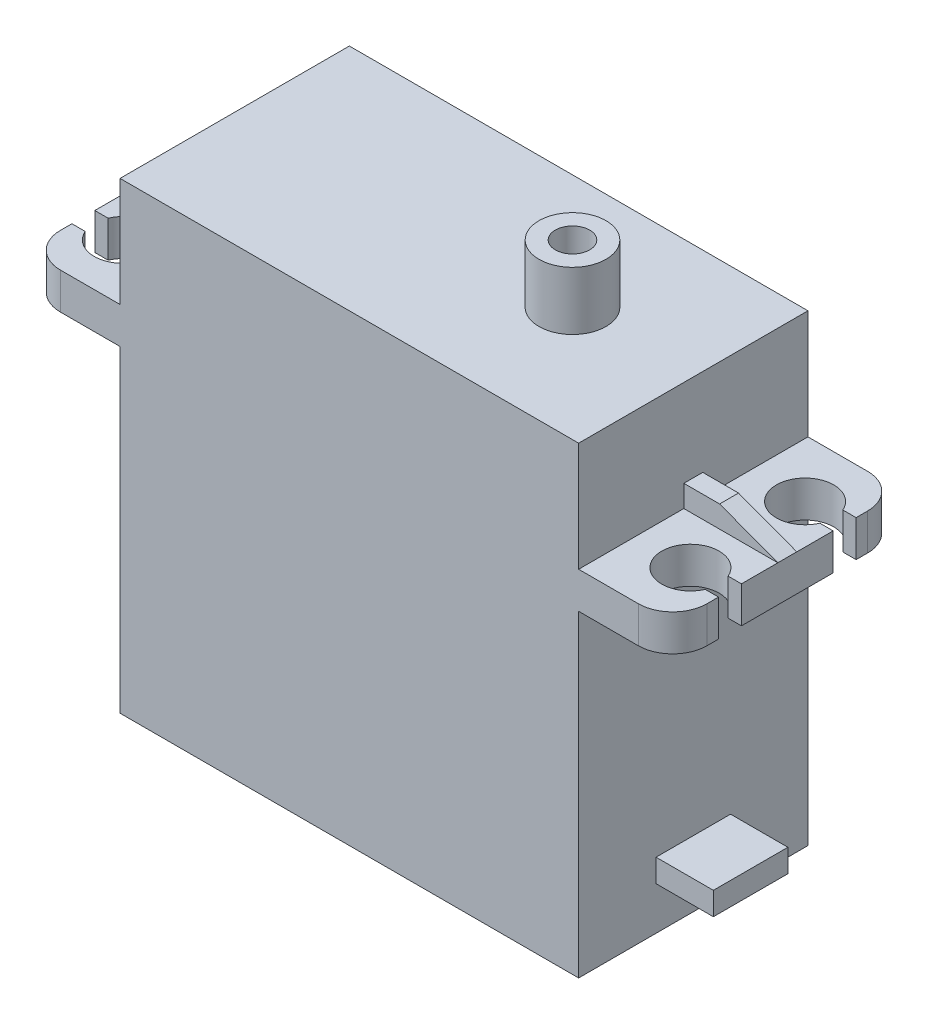
from build123d import *

# Parameters (mm, degrees)
SKETCH1_W            = 40
SKETCH1_H            = 20
BOSS_EXTRUDE1_DEPTH  = 40.4
SKETCH2_W            = 56.4
SKETCH2_H            = 20
BOSS_EXTRUDE2_DEPTH  = 3.175
CUT_EXTRUDE1_REACH   = 44.994
SKETCH3_R            = 2.5
CUT_EXTRUDE2_REACH   = 44.994
MIRROR2_COPY_1_REACH = 44.994
FILLET1_R            = 3
SKETCH5_W            = 6.5
SKETCH5_H            = 2
BOSS_EXTRUDE3_DEPTH  = 5
SKETCH6_R            = 2.921
BOSS_EXTRUDE4_DEPTH  = 5.08
SKETCH7_W            = 8.2
SKETCH7_H            = 1.651
BOSS_EXTRUDE5_DEPTH  = 1.905
CHAMFER1_SIZE        = 1.9
CHAMFER1_SIZE2       = 5.08
CHAMFER2_SIZE        = 5.08
CHAMFER2_SIZE2       = 1.9
SKETCH8_R            = 1.5
CUT_EXTRUDE3_DEPTH   = 9.25


with BuildPart() as part:
    # Sketch1 → Boss-Extrude1 (new body)
    with BuildSketch(Plane(origin=(0, 0, 0), x_dir=(1, 0, 0), z_dir=(0, 1, 0))):
        Rectangle(SKETCH1_W, SKETCH1_H)
    extrude(amount=BOSS_EXTRUDE1_DEPTH)

    # Sketch2 → Boss-Extrude2 (add)
    with BuildSketch(Plane(origin=(0, 27.7, 0), x_dir=(1, 0, 0), z_dir=(0, 1, 0))):
        Rectangle(SKETCH2_W, SKETCH2_H)
    extrude(amount=BOSS_EXTRUDE2_DEPTH)

    # Sketch3 → Cut-Extrude1 (cut, up to next)
    with BuildSketch(Plane(origin=(0, 30.875, 0), x_dir=(1, 0, 0), z_dir=(0, 1, 0)), mode=Mode.PRIVATE) as cut_extrude1_sk1:
        with Locations(Location((-24.75, 5, 0), (0, 0, 270))):
            Circle(SKETCH3_R)
    cut_extrude1_tool1 = extrude(cut_extrude1_sk1.sketch, amount=-CUT_EXTRUDE1_REACH, mode=Mode.PRIVATE) & part.part
    # Sketch3 → Cut-Extrude1 (cut, up to next)
    with BuildSketch(Plane(origin=(0, 30.875, 0), x_dir=(1, 0, 0), z_dir=(0, 1, 0)), mode=Mode.PRIVATE) as cut_extrude1_sk2:
        with Locations(Location((-24.75, -5, 0), (0, 0, 270))):
            Circle(SKETCH3_R)
    cut_extrude1_tool2 = extrude(cut_extrude1_sk2.sketch, amount=-CUT_EXTRUDE1_REACH, mode=Mode.PRIVATE) & part.part
    # Sketch3 → Cut-Extrude1 (cut, up to next)
    with BuildSketch(Plane(origin=(0, 30.875, 0), x_dir=(1, 0, 0), z_dir=(0, 1, 0)), mode=Mode.PRIVATE) as cut_extrude1_sk3:
        with Locations(Location((24.75, 5, 0), (0, 0, 270))):
            Circle(SKETCH3_R)
    cut_extrude1_tool3 = extrude(cut_extrude1_sk3.sketch, amount=-CUT_EXTRUDE1_REACH, mode=Mode.PRIVATE) & part.part
    # Sketch3 → Cut-Extrude1 (cut, up to next)
    with BuildSketch(Plane(origin=(0, 30.875, 0), x_dir=(1, 0, 0), z_dir=(0, 1, 0)), mode=Mode.PRIVATE) as cut_extrude1_sk4:
        with Locations(Location((24.75, -5, 0), (0, 0, 270))):
            Circle(SKETCH3_R)
    cut_extrude1_tool4 = extrude(cut_extrude1_sk4.sketch, amount=-CUT_EXTRUDE1_REACH, mode=Mode.PRIVATE) & part.part
    add(cut_extrude1_tool1.solids().sort_by_distance((-24.75, 30.875, -5))[0], mode=Mode.SUBTRACT)
    add(cut_extrude1_tool2.solids().sort_by_distance((-24.75, 30.875, 5))[0], mode=Mode.SUBTRACT)
    add(cut_extrude1_tool3.solids().sort_by_distance((24.75, 30.875, -5))[0], mode=Mode.SUBTRACT)
    add(cut_extrude1_tool4.solids().sort_by_distance((24.75, 30.875, 5))[0], mode=Mode.SUBTRACT)

    # Sketch4 → Cut-Extrude2 (cut, up to next)
    with BuildSketch(Plane(origin=(0, 30.875, 0), x_dir=(1, 0, 0), z_dir=(0, 1, 0)), mode=Mode.PRIVATE) as cut_extrude2_sk1:
        with BuildLine():
            Line((-27.041287847, -4), (-28.2, -4))
            Line((-28.2, -4), (-28.2, -6))
            Line((-28.2, -6), (-27.041287847, -6))
            ThreePointArc((-27.041287847, -6), (-27.25, -5), (-27.041287847, -4))
        make_face()
    cut_extrude2_tool1 = extrude(cut_extrude2_sk1.sketch, amount=-CUT_EXTRUDE2_REACH, mode=Mode.PRIVATE) & part.part
    cut_extrude2 = cut_extrude2_tool1.solids().sort_by_distance((-27.68894, 30.875, 5))[0]
    add(cut_extrude2, mode=Mode.SUBTRACT)

    # Mirror1: Cut-Extrude2 across plane
    add(cut_extrude2.mirror(Plane(origin=(0, 0, 0), x_dir=(0, 0, 1), z_dir=(1, 0, 0))), mode=Mode.SUBTRACT)

    # Mirror2: Cut-Extrude2 across plane
    add(cut_extrude2.mirror(Plane.XY), mode=Mode.SUBTRACT)

    # Mirror2 copy 1 sketch → Mirror2 copy 1 (cut, up to next)
    with BuildSketch(Plane(origin=(0, 30.875, 0), x_dir=(-1, 0, 0), z_dir=(0, 1, 0)), mode=Mode.PRIVATE) as mirror2_copy_1_sk1:
        with BuildLine():
            Line((-27.041287847, -4), (-28.2, -4))
            Line((-28.2, -4), (-28.2, -6))
            Line((-28.2, -6), (-27.041287847, -6))
            ThreePointArc((-27.041287847, -6), (-27.25, -5), (-27.041287847, -4))
        make_face()
    mirror2_copy_1_tool1 = extrude(mirror2_copy_1_sk1.sketch, amount=-MIRROR2_COPY_1_REACH, mode=Mode.PRIVATE) & part.part
    add(mirror2_copy_1_tool1.solids().sort_by_distance((27.68894, 30.875, -5))[0], mode=Mode.SUBTRACT)

    # Fillet1
    fillet1_edges = [part.edges().sort_by_distance(p)[0] for p in [
        (28.2, 29.2875, -10),
        (-28.2, 29.2875, 10),
        (28.2, 29.2875, 10),
        (-28.2, 29.2875, -10),
    ]]
    fillet(fillet1_edges, radius=FILLET1_R)

    # Sketch5 → Boss-Extrude3 (add)
    with BuildSketch(Plane(origin=(20, 0, 0), x_dir=(0, 0, -1), z_dir=(1, 0, 0))):
        with Locations((0, 4.75)):
            Rectangle(SKETCH5_W, SKETCH5_H)
    extrude(amount=BOSS_EXTRUDE3_DEPTH)

    # Sketch6 → Boss-Extrude4 (add)
    with BuildSketch(Plane(origin=(0, 40.4, 0), x_dir=(1, 0, 0), z_dir=(0, 1, 0))):
        with Locations(Location((9.464, 0, 0), (0, 0, 270))):
            Circle(SKETCH6_R)
    extrude(amount=BOSS_EXTRUDE4_DEPTH)

    # Sketch7 → Boss-Extrude5 (add)
    with BuildSketch(Plane(origin=(0, 30.875, 0), x_dir=(1, 0, 0), z_dir=(0, 1, 0))):
        with Locations((24.1, 0)):
            Rectangle(SKETCH7_W, SKETCH7_H)
    boss_extrude5 = extrude(amount=BOSS_EXTRUDE5_DEPTH)

    # Chamfer1
    chamfer1_edges = [part.edges().sort_by_distance(p)[0] for p in [
        (28.2, 32.78, 0),
    ]]
    chamfer1_side = [part.faces().sort_by_distance(p)[0] for p in [
        (28.2, 29.567361633, 0),
    ]]
    chamfer(chamfer1_edges, length=CHAMFER1_SIZE, length2=CHAMFER1_SIZE2, reference=chamfer1_side[0])

    # Mirror3: Boss-Extrude5 across plane
    add(boss_extrude5.mirror(Plane(origin=(0, 0, 0), x_dir=(0, 0, 1), z_dir=(1, 0, 0))))

    # Chamfer2
    chamfer2_edges = [part.edges().sort_by_distance(p)[0] for p in [
        (-28.2, 32.78, 0),
    ]]
    chamfer2_side = [part.faces().sort_by_distance(p)[0] for p in [
        (-24.1, 32.78, 0),
    ]]
    chamfer(chamfer2_edges, length=CHAMFER2_SIZE, length2=CHAMFER2_SIZE2, reference=chamfer2_side[0])

    # Sketch8 → Cut-Extrude3 (cut)
    with BuildSketch(Plane(origin=(0, 45.48, 0), x_dir=(1, 0, 0), z_dir=(0, 1, 0))):
        with Locations(Location((9.464, 0, 0), (0, 0, 270))):
            Circle(SKETCH8_R)
    extrude(amount=-CUT_EXTRUDE3_DEPTH, mode=Mode.SUBTRACT)


solid = part.part
